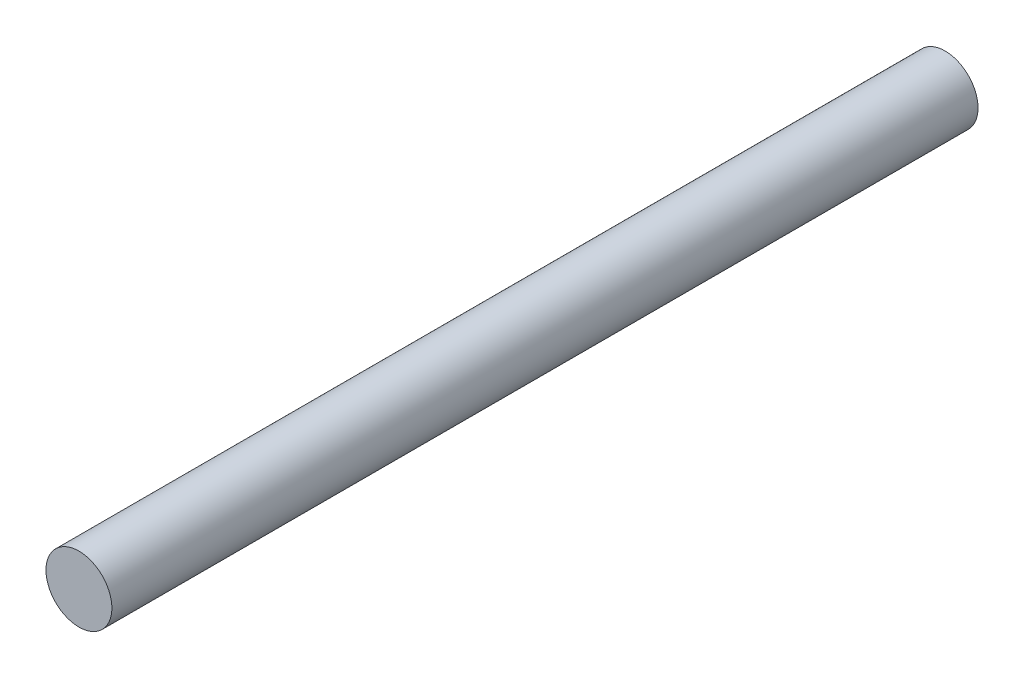
from build123d import *

# Parameters (mm, degrees)
BOSS_EXTRUDE1_DEPTH      = 41.75
BOSS_EXTRUDE1_DEPTH_BACK = 41.75
SKETCH3_R                = 3.175


with BuildPart() as part:
    # Sketch3 → Boss-Extrude1 (new, two sides: drawn at the far end of the back side and taken through both)
    with BuildSketch(Plane.XY.offset(-BOSS_EXTRUDE1_DEPTH_BACK)):
        with Locations(Location((0, 0, 0), (0, 0, 180))):
            Circle(SKETCH3_R)
    extrude(amount=BOSS_EXTRUDE1_DEPTH + BOSS_EXTRUDE1_DEPTH_BACK)


solid = part.part
